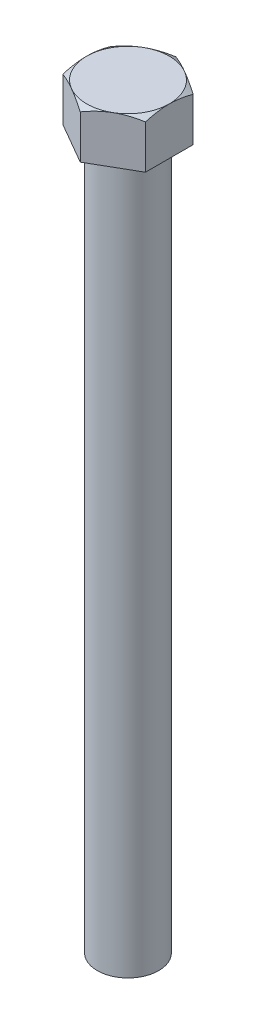
from build123d import *

# Parameters (mm, degrees)
BOSS_EXTRUDE1_DEPTH = 2.54
SKETCH2_OUTSIDE_W   = 31.388
SKETCH2_OUTSIDE_H   = 32.764
SKETCH2_OUTSIDE_R   = 4.445
CUT_EXTRUDE1_DEPTH  = 5.08
CUT_EXTRUDE1_DRAFT  = -60
SKETCH3_R           = 3.302
BOSS_EXTRUDE2_DEPTH = 76.2


with BuildPart() as part:
    # Sketch1 → Boss-Extrude1 (new, symmetric)
    with BuildSketch(Plane(origin=(0, 0, 0), x_dir=(1, 0, 0), z_dir=(0, 1, 0))):
        Polygon((0, 5.132643893), (-4.445, 2.566321947), (-4.445, -2.566321947), (0, -5.132643893), (4.445, -2.566321947), (4.445, 2.566321947), align=None)
    extrude(amount=BOSS_EXTRUDE1_DEPTH, both=True)


with BuildPart() as cut_extrude1_tool:
    # Sketch2 outside → Cut-Extrude1 (with draft: the straight prism first)
    with BuildSketch(Plane(origin=(0, 2.54, 0), x_dir=(1, 0, 0), z_dir=(0, 1, 0))):
        Rectangle(SKETCH2_OUTSIDE_W, SKETCH2_OUTSIDE_H)
        Circle(SKETCH2_OUTSIDE_R, mode=Mode.SUBTRACT)
    extrude(amount=-CUT_EXTRUDE1_DEPTH)
    # Cut-Extrude1: the draft: its side faces are tilted about the plane it starts from
    cut_extrude1_sides = [cut_extrude1_tool.faces().sort_by_distance(p)[0] for p in [
        (0, 0, 16.382),
        (15.694, 0, 0),
        (0, 0, -16.382),
        (-15.694, 0, 0),
        (-4.445, 0, 0),
    ]]
    draft(cut_extrude1_sides, Plane(origin=(0, 2.54, 0), x_dir=(1, 0, 0), z_dir=(0, 1, 0)), CUT_EXTRUDE1_DRAFT)


with BuildPart() as part_1:
    add(part.part)

    # Cut-Extrude1: cut by cut_extrude1_tool
    add(cut_extrude1_tool.part, mode=Mode.SUBTRACT)

    # Sketch3 → Boss-Extrude2 (add)
    with BuildSketch(Plane(origin=(0, -2.54, 0), x_dir=(-1, 0, 0), z_dir=(0, -1, 0))):
        with Locations(Location((0, 0, 0), (0, 0, 270))):
            Circle(SKETCH3_R)
    extrude(amount=BOSS_EXTRUDE2_DEPTH)


solid = part_1.part
